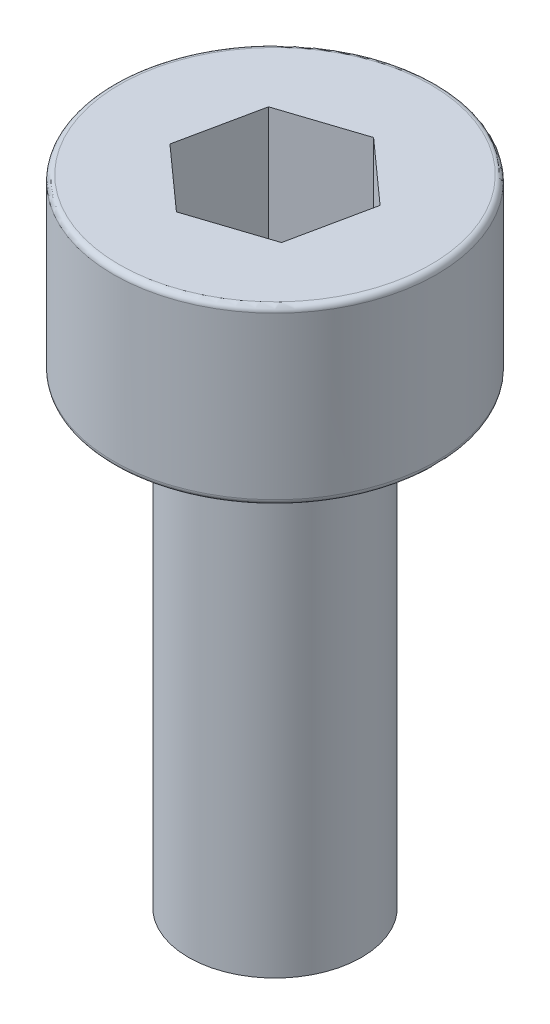
from build123d import *

# Parameters (mm, degrees)
CUT_EXTRUDE_1_DEPTH = 2
FILLET_1_R          = 0.1


with BuildPart() as part:
    # 草图1 → 旋转1 (revolve)
    with BuildSketch(Plane.XY, mode=Mode.PRIVATE) as revolve_1_sk:
        Polygon((0, 0), (0, 11), (2.8, 11), (2.8, 8), (1.5, 8), (1.5, 0), align=None)
    revolve(revolve_1_sk.sketch.rotate(Axis((0, 0, 0), (0, 1, 0)), 90), axis=Axis((0, 0, 0), (0, 1, 0)))

    # 草图2 → 切除-拉伸1 (cut)
    with BuildSketch(Plane(origin=(0, 11, 0), x_dir=(1, 0, 0), z_dir=(0, 1, 0))):
        Polygon((1.075295482, -0.962846281), (1.37149708, 0.449810063), (0.296201598, 1.412656344), (-1.075295482, 0.962846281), (-1.37149708, -0.449810063), (-0.296201598, -1.412656344), align=None)
    extrude(amount=-CUT_EXTRUDE_1_DEPTH, mode=Mode.SUBTRACT)

    # 圆角1
    fillet_1_edges = [part.edges().sort_by_distance(p)[0] for p in [
        (0, 8, 2.8),
        (0, 11, 2.8),
    ]]
    fillet(fillet_1_edges, radius=FILLET_1_R)


solid = part.part
